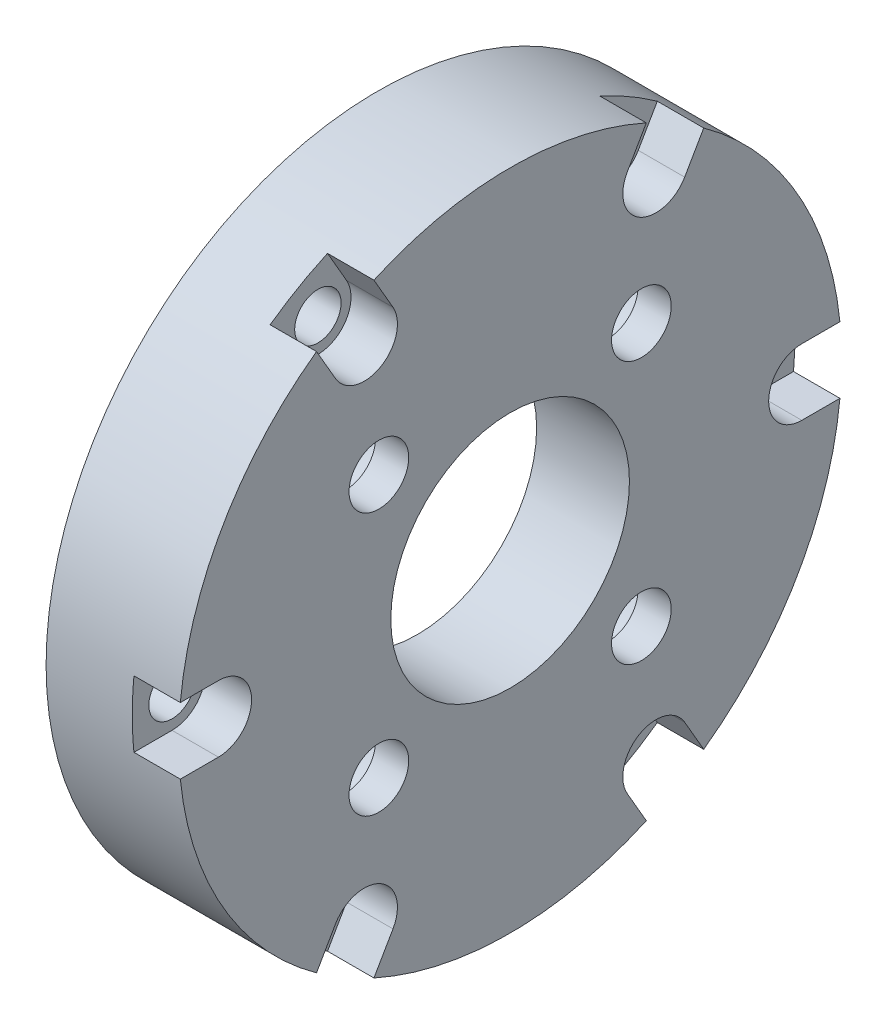
from build123d import *

# Parameters (mm, degrees)
ENL_V_MAT_EXTRU_1_DEPTH                         = 3.5
R_P_TITION_CIRCULAIRE1_COUNT                    = 6
ESQUISSE3_R                                     = 1.75
ENL_V_MAT_EXTRU_2_DEPTH                         = 36.947878936
R_P_TITION_CIRCULAIRE2_COUNT                    = 6
CHAMBRAGE_POUR_VIS_T_TE_CYLINDRIQUE_D           = 4.5
CHAMBRAGE_POUR_VIS_T_TE_CYLINDRIQUE_CBORE_D     = 8
CHAMBRAGE_POUR_VIS_T_TE_CYLINDRIQUE_CBORE_DEPTH = 4.5
R_P_TITION_CIRCULAIRE3_COUNT                    = 4


with BuildPart() as part:
    # Esquisse1 → Base-Révolution (revolve)
    with BuildSketch(Plane.XY, mode=Mode.PRIVATE) as base_r_volution_sk:
        Polygon((-5, 25), (-5, 19), (-2, 19), (-2, 9), (5, 9), (5, 25), align=None)
    revolve(base_r_volution_sk.sketch.rotate(Axis((-14.936373376, 0, 0), (1, 0, 0)), 90), axis=Axis((-14.936373376, 0, 0), (1, 0, 0)))

    # Esquisse2 → Enlèv. mat.-Extru.1 (cut)
    with BuildSketch(Plane(origin=(5, 0, 0), x_dir=(0, 0, -1), z_dir=(1, 0, 0))):
        with BuildLine():
            Line((-22, 2.5), (-25.435164017, 2.5))
            Line((-25.435164017, 2.5), (-25.435164017, -2.5))
            Line((-25.435164017, -2.5), (-22, -2.5))
            ThreePointArc((-22, -2.5), (-19.5, 0), (-22, 2.5))
        make_face()
    enl_v_mat_extru_1 = extrude(amount=-ENL_V_MAT_EXTRU_1_DEPTH, mode=Mode.SUBTRACT)

    # Répétition circulaire1: Enlèv. mat.-Extru.1 ×6 about axis
    r_p_tition_circulaire1_axis = Axis((0, 0, 0), (1, 0, 0))
    for i in range(1, R_P_TITION_CIRCULAIRE1_COUNT):
        add(enl_v_mat_extru_1.rotate(r_p_tition_circulaire1_axis, i * 360 / R_P_TITION_CIRCULAIRE1_COUNT), mode=Mode.SUBTRACT)

    # Esquisse3 → Enlèv. mat.-Extru.2 (cut, through all)
    with BuildSketch(Plane(origin=(1.5, 0, 0), x_dir=(0, 0, -1), z_dir=(1, 0, 0))):
        with Locations((-22, 0)):
            Circle(ESQUISSE3_R)
    enl_v_mat_extru_2 = extrude(amount=-ENL_V_MAT_EXTRU_2_DEPTH, mode=Mode.SUBTRACT)

    # Répétition circulaire2: Enlèv. mat.-Extru.2 ×6 about axis
    r_p_tition_circulaire2_axis = Axis((0, 0, 0), (1, 0, 0))
    for i in range(1, R_P_TITION_CIRCULAIRE2_COUNT):
        add(enl_v_mat_extru_2.rotate(r_p_tition_circulaire2_axis, i * 360 / R_P_TITION_CIRCULAIRE2_COUNT), mode=Mode.SUBTRACT)

    # Chambrage pour vis à tête cylindrique à 6 pans creux (vis CHC) M41 (through all)
    with Locations(Plane.ZY.offset(2)):
        with Locations((9.899494937, 9.899494937)):
            chambrage_pour_vis_t_te_cylindrique = CounterBoreHole(CHAMBRAGE_POUR_VIS_T_TE_CYLINDRIQUE_D / 2, CHAMBRAGE_POUR_VIS_T_TE_CYLINDRIQUE_CBORE_D / 2, CHAMBRAGE_POUR_VIS_T_TE_CYLINDRIQUE_CBORE_DEPTH)

    # Répétition circulaire3: Chambrage pour vis à tête cylindrique à 6 pans creux (vis CHC) M41 ×4 about axis
    r_p_tition_circulaire3_axis = Axis((0, 0, 0), (1, 0, 0))
    for i in range(1, R_P_TITION_CIRCULAIRE3_COUNT):
        add(chambrage_pour_vis_t_te_cylindrique.rotate(r_p_tition_circulaire3_axis, i * 360 / R_P_TITION_CIRCULAIRE3_COUNT), mode=Mode.SUBTRACT)


solid = part.part
